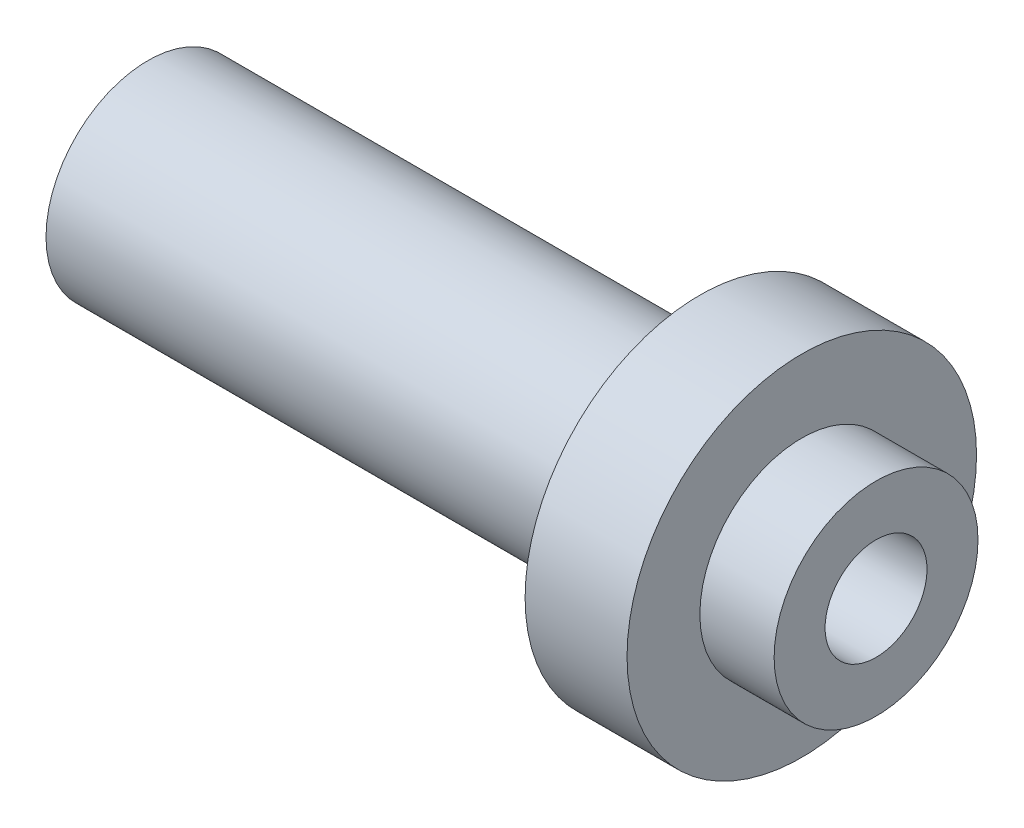
from build123d import *

# Parameters (mm, degrees)
TROU_TARAUD_M8X1_01_D     = 7
TROU_TARAUD_M8X1_01_DEPTH = 30
TROU_TARAUD_M8X1_01_TIP   = 2.103012167


with BuildPart() as part:
    # Sketch1 → Revolve1 (revolve)
    with BuildSketch(Plane.XY, mode=Mode.PRIVATE) as revolve1_sk:
        Polygon((-5.1, 12), (-5.1, 7), (0, 7), (0, 0), (-50, 0), (-50, 7), (-12.1, 7), (-12.1, 12), align=None)
    revolve(revolve1_sk.sketch.rotate(Axis((-78.343949045, 0, 0), (1, 0, 0)), 90), axis=Axis((-78.343949045, 0, 0), (1, 0, 0)))

    # Trou taraudé M8x1.01
    with Locations(Plane(origin=(0, 0, 0), x_dir=(0, 0, -1), z_dir=(1, 0, 0))):
        with Locations((0, 0)):
            Hole(TROU_TARAUD_M8X1_01_D / 2, depth=TROU_TARAUD_M8X1_01_DEPTH)
            with Locations((0, 0, -(TROU_TARAUD_M8X1_01_DEPTH + TROU_TARAUD_M8X1_01_TIP / 2))):  # 118° drill point
                Cone(0, TROU_TARAUD_M8X1_01_D / 2, TROU_TARAUD_M8X1_01_TIP, mode=Mode.SUBTRACT)


solid = part.part
